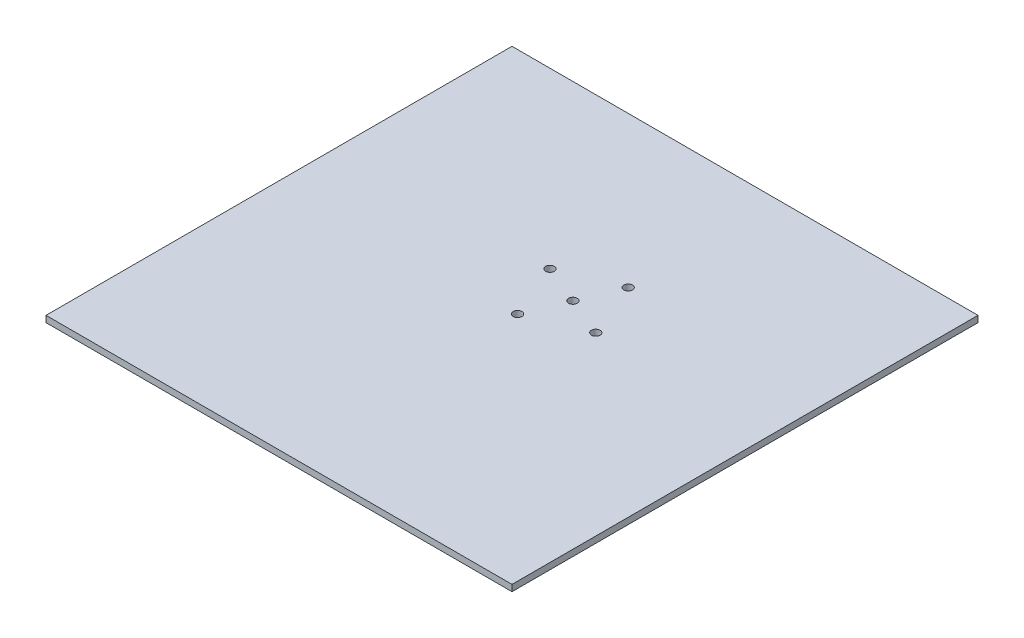
from build123d import *

# Parameters (mm, degrees)
SKETCH_1_W               = 220
SKETCH_1_H               = 220
EXTRUDE_1_DEPTH          = 3
CUT_EXTRUDE_1_DEPTH      = 156.592416268
CUT_EXTRUDE_1_DEPTH_BACK = 156.592416268
SKETCH_3_R               = 2.05


with BuildPart() as part:
    # 草图1 → 凸台-拉伸1 (new body)
    with BuildSketch(Plane(origin=(0, 0, 0), x_dir=(1, 0, 0), z_dir=(0, 1, 0))):
        Rectangle(SKETCH_1_W, SKETCH_1_H)
    extrude(amount=EXTRUDE_1_DEPTH)

    # 草图3 → 切除-拉伸1 (cut, two sides: drawn at the far end of the back side and taken through both)
    with BuildSketch(Plane.XZ.offset(-CUT_EXTRUDE_1_DEPTH_BACK)):
        with Locations(Location((16.054996524, -38.810270375, 0), (0, 0, 270))):
            Circle(SKETCH_3_R)
        with Locations(Location((8.409760084, -20.329189244, 0), (0, 0, 270))):
            Circle(SKETCH_3_R)
        with Locations(Location((26.890841215, -12.683952804, 0), (0, 0, 270))):
            Circle(SKETCH_3_R)
        with Locations(Location((0.764523644, -1.848108113, 0), (0, 0, 270))):
            Circle(SKETCH_3_R)
        with Locations(Location((-10.071321047, -27.974425684, 0), (0, 0, 270))):
            Circle(SKETCH_3_R)
    extrude(amount=CUT_EXTRUDE_1_DEPTH + CUT_EXTRUDE_1_DEPTH_BACK, mode=Mode.SUBTRACT)


solid = part.part
